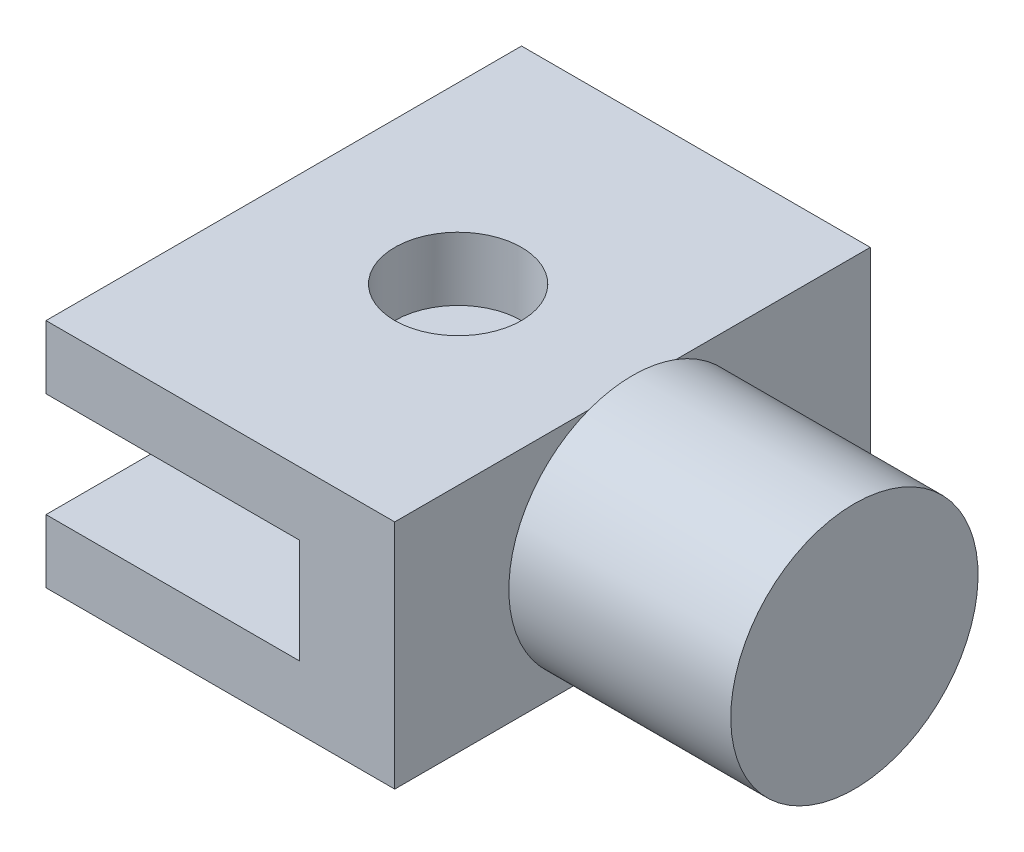
from build123d import *

# Parameters (mm, degrees)
BOSS_EXTRUDE1_DEPTH = 15
SKETCH5_R           = 2
CUT_EXTRUDE1_DEPTH  = 19.501081049
SKETCH4_R           = 3.9
BOSS_EXTRUDE2_DEPTH = 7


with BuildPart() as part:
    # Sketch1 → Boss-Extrude1 (new body)
    with BuildSketch(Plane.XY):
        Polygon((-8, 3.3), (-8, 5.3), (3, 5.3), (3, -2), (-8, -2), (-8, 0), (0, 0), (0, 3.3), align=None)
    extrude(amount=BOSS_EXTRUDE1_DEPTH)

    # Sketch5 → Cut-Extrude1 (cut, through all)
    with BuildSketch(Plane(origin=(0, 5.3, 0), x_dir=(1, 0, 0), z_dir=(0, 1, 0))):
        with Locations(Location((-2.5, -7.5, 0), (0, 0, 270))):
            Circle(SKETCH5_R)
    extrude(amount=-CUT_EXTRUDE1_DEPTH, mode=Mode.SUBTRACT)

    # Sketch4 → Boss-Extrude2 (add)
    with BuildSketch(Plane(origin=(3, 0, 0), x_dir=(0, 0, -1), z_dir=(1, 0, 0))):
        with Locations(Location((-7.5, 1.65, 0), (0, 0, 249.37361895))):
            Circle(SKETCH4_R)
    extrude(amount=BOSS_EXTRUDE2_DEPTH)


solid = part.part
